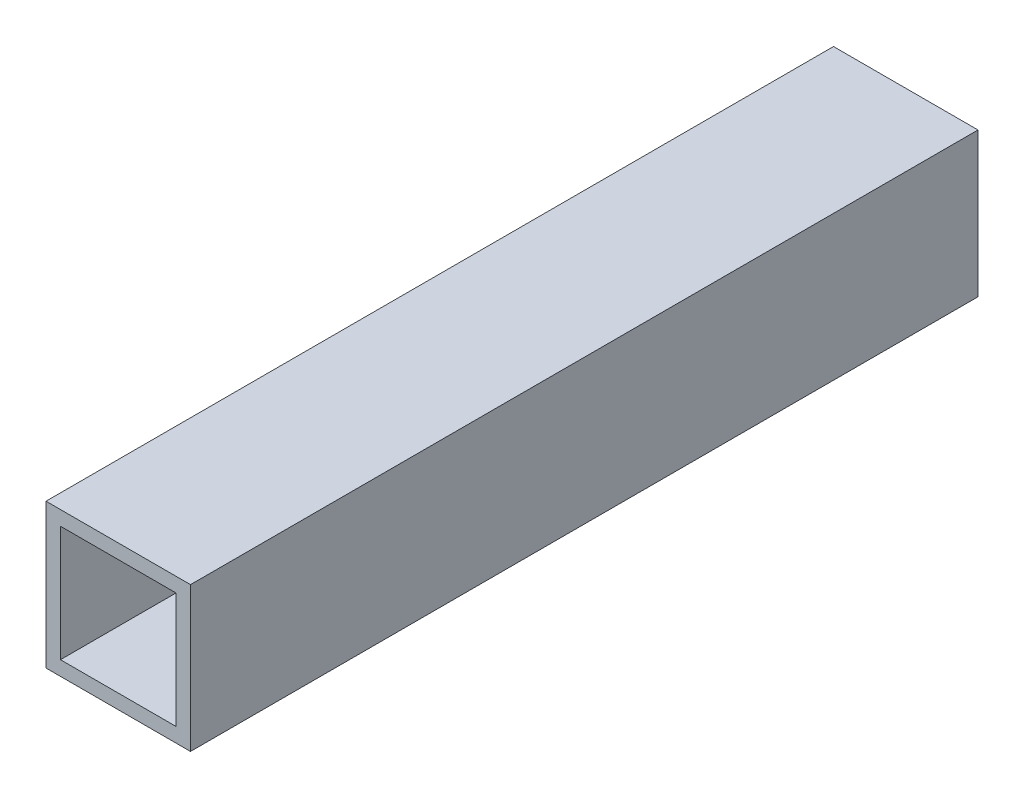
from build123d import *

# Parameters (mm, degrees)
SKETCH_1_W      = 40
SKETCH_1_H      = 40
SKETCH_1_W_2    = 32
SKETCH_1_H_2    = 32
EXTRUDE_1_DEPTH = 218


with BuildPart() as part:
    # Эскиз1 → Вытянуть-Тонкостенный1 (new body)
    with BuildSketch(Plane.XY):
        with Locations((20, 20)):
            Rectangle(SKETCH_1_W, SKETCH_1_H)
        with Locations((20, 20)):
            Rectangle(SKETCH_1_W_2, SKETCH_1_H_2, mode=Mode.SUBTRACT)
    extrude(amount=EXTRUDE_1_DEPTH)


solid = part.part
